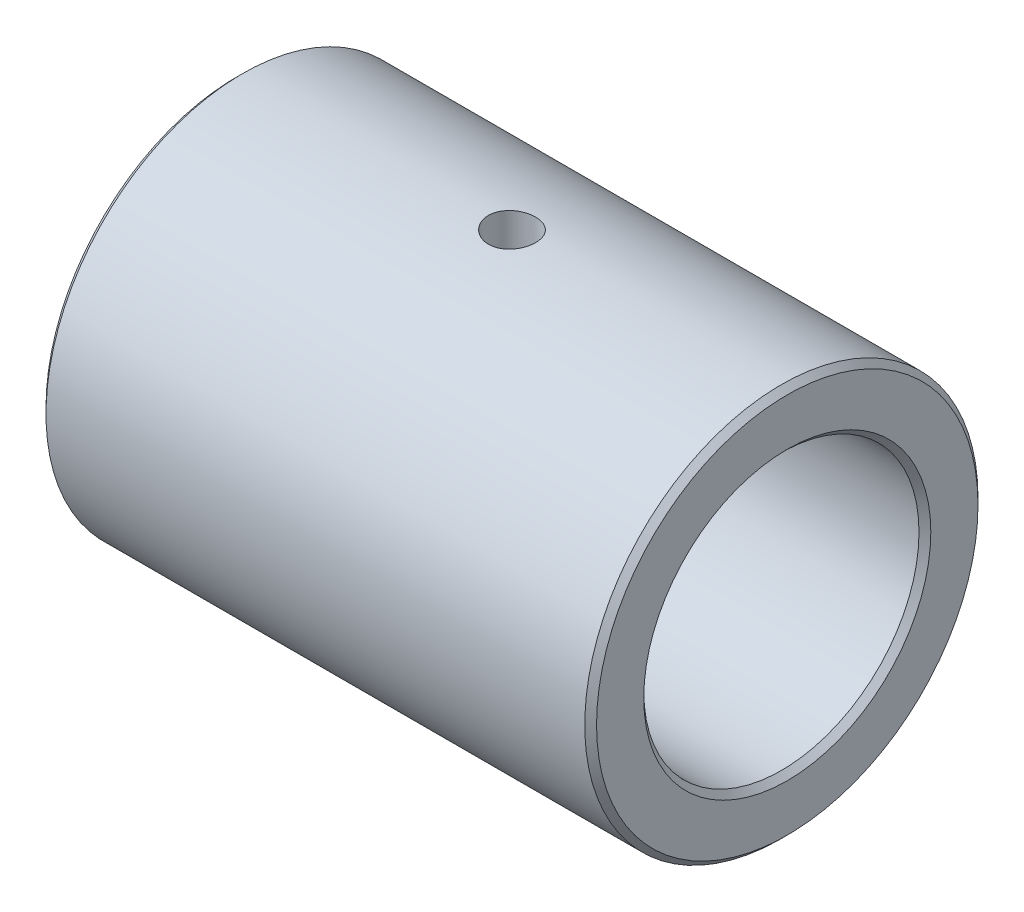
from build123d import *

# Parameters (mm, degrees)
SKETCH_1_R              = 50
SKETCH_1_R_2            = 30.5
EXTRUDE_1_DEPTH         = 70
SKETCH_4_R              = 35
CUT_EXTRUDE_1_DEPTH     = 61
CUT_EXTRUDE_START       = -61
SKETCH_5_R              = 35
CUT_EXTRUDE_2_DEPTH     = 61
CHAMFER_1_SIZE          = 1.5
HOLE_WIZARD_M14_1_D     = 12
HOLE_WIZARD_M14_1_DEPTH = 38
HOLE_WIZARD_M14_1_TIP   = 3.605163714


with BuildPart() as part:
    # 草图1 → 凸台-拉伸1 (new, symmetric)
    with BuildSketch(Plane(origin=(0, 0, 0), x_dir=(0, 0, -1), z_dir=(1, 0, 0))):
        Circle(SKETCH_1_R)
        Circle(SKETCH_1_R_2, mode=Mode.SUBTRACT)
    extrude(amount=EXTRUDE_1_DEPTH, both=True)

    # 草图4 → 切除-拉伸1 (cut)
    with BuildSketch(Plane.ZY.offset(70)):
        Circle(SKETCH_4_R)
    extrude(amount=-CUT_EXTRUDE_1_DEPTH, mode=Mode.SUBTRACT)

    # 草图5 → 切除-拉伸2 (cut)
    with BuildSketch(Plane(origin=(70, 0, 0), x_dir=(0, 0, -1), z_dir=(1, 0, 0)).offset(CUT_EXTRUDE_START)):
        with Locations(Location((0, 0, 0), (0, 0, 180))):
            Circle(SKETCH_5_R)
    extrude(amount=CUT_EXTRUDE_2_DEPTH, mode=Mode.SUBTRACT)

    # 倒角1
    chamfer_1_edges = [part.edges().sort_by_distance(p)[0] for p in [
        (-70, 0, -35),
        (70, 0, -35),
        (-70, 0, 50),
        (70, 0, 50),
    ]]
    chamfer(chamfer_1_edges, length=CHAMFER_1_SIZE)

    # M14 螺纹孔1
    with Locations(Plane(origin=(0, 50, 0), x_dir=(1, 0, 0), z_dir=(0, 1, 0))):
        with Locations((0, 0)):
            Hole(HOLE_WIZARD_M14_1_D / 2, depth=HOLE_WIZARD_M14_1_DEPTH)
            with Locations((0, 0, -(HOLE_WIZARD_M14_1_DEPTH + HOLE_WIZARD_M14_1_TIP / 2))):  # 118° drill point
                Cone(0, HOLE_WIZARD_M14_1_D / 2, HOLE_WIZARD_M14_1_TIP, mode=Mode.SUBTRACT)


solid = part.part
